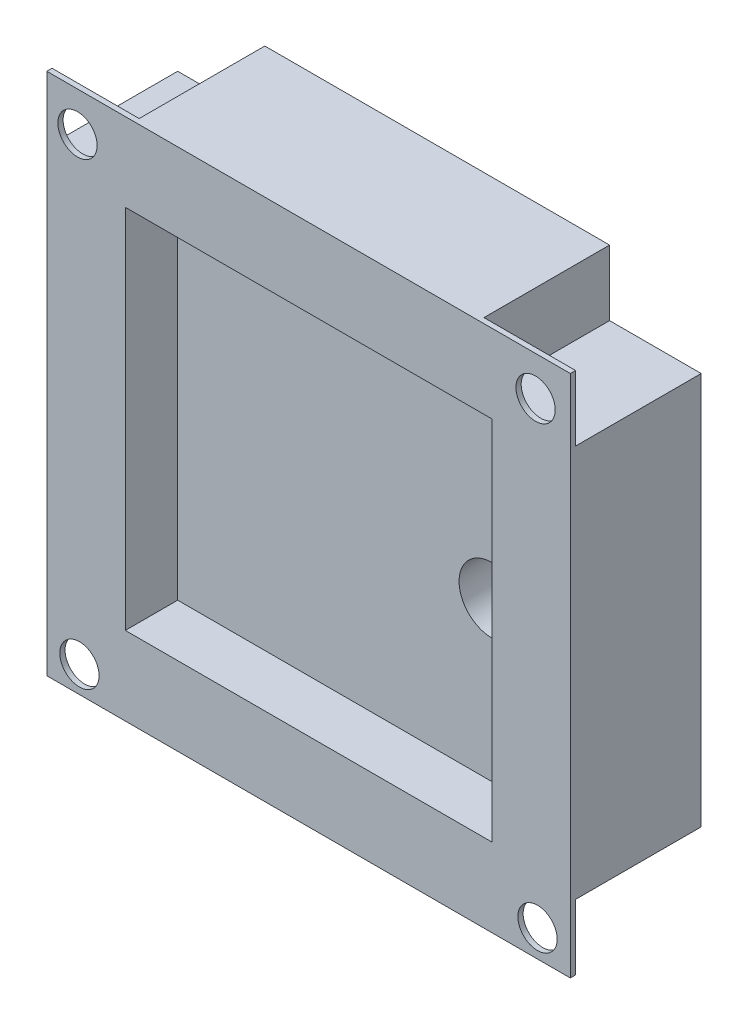
from build123d import *

# Parameters (mm, degrees)
SKETCH1_W           = 50.8
SKETCH1_H           = 50.8
BOSS_EXTRUDE1_DEPTH = 12.7
SHELL1_T            = -7.62
SKETCH3_W           = 8.89
SKETCH3_H           = 6.35
SKETCH3_W_2         = 8.455127559
CUT_EXTRUDE2_DEPTH  = 12.192
SKETCH4_R           = 1.905
CUT_EXTRUDE3_DEPTH  = 20.574
SKETCH6_R           = 3.175
CUT_EXTRUDE5_DEPTH  = 8.89


with BuildPart() as part:
    # Sketch1 → Boss-Extrude1 (new body)
    with BuildSketch(Plane.XY):
        with Locations((25.4, 25.4)):
            Rectangle(SKETCH1_W, SKETCH1_H)
    extrude(amount=BOSS_EXTRUDE1_DEPTH)

    # Shell1
    shell1_openings = [part.faces().sort_by_distance(p)[0] for p in [
        (25.4, 25.4, 12.7),
    ]]
    offset(amount=SHELL1_T, openings=shell1_openings, kind=Kind.INTERSECTION)

    # Sketch3 → Cut-Extrude2 (cut)
    with BuildSketch(Plane(origin=(0, 0, 0), x_dir=(-1, 0, 0), z_dir=(0, 0, -1))):
        with Locations((-46.355, 47.625)):
            Rectangle(SKETCH3_W, SKETCH3_H)
        with Locations((-46.355, 3.175)):
            Rectangle(SKETCH3_W, SKETCH3_H)
        with Locations((-4.445, 3.175)):
            Rectangle(SKETCH3_W, SKETCH3_H)
        with Locations((-4.22756378, 47.625)):
            Rectangle(SKETCH3_W_2, SKETCH3_H)
    extrude(amount=-CUT_EXTRUDE2_DEPTH, mode=Mode.SUBTRACT)

    # Sketch4 → Cut-Extrude3 (cut)
    with BuildSketch(Plane.XY.offset(12.7)):
        with Locations((2.97778213, 46.99)):
            Circle(SKETCH4_R)
        with Locations((47.42778213, 47.001802338)):
            Circle(SKETCH4_R)
        with Locations((3.166736342, 2.54)):
            Circle(SKETCH4_R)
        with Locations((47.616736342, 2.617819139)):
            Circle(SKETCH4_R)
    extrude(amount=-CUT_EXTRUDE3_DEPTH, mode=Mode.SUBTRACT)

    # Sketch6 → Cut-Extrude5 (cut)
    with BuildSketch(Plane(origin=(0, 0, 0), x_dir=(-1, 0, 0), z_dir=(0, 0, -1))):
        with Locations((-38.1, 22.86)):
            Circle(SKETCH6_R)
    extrude(amount=-CUT_EXTRUDE5_DEPTH, mode=Mode.SUBTRACT)


solid = part.part
